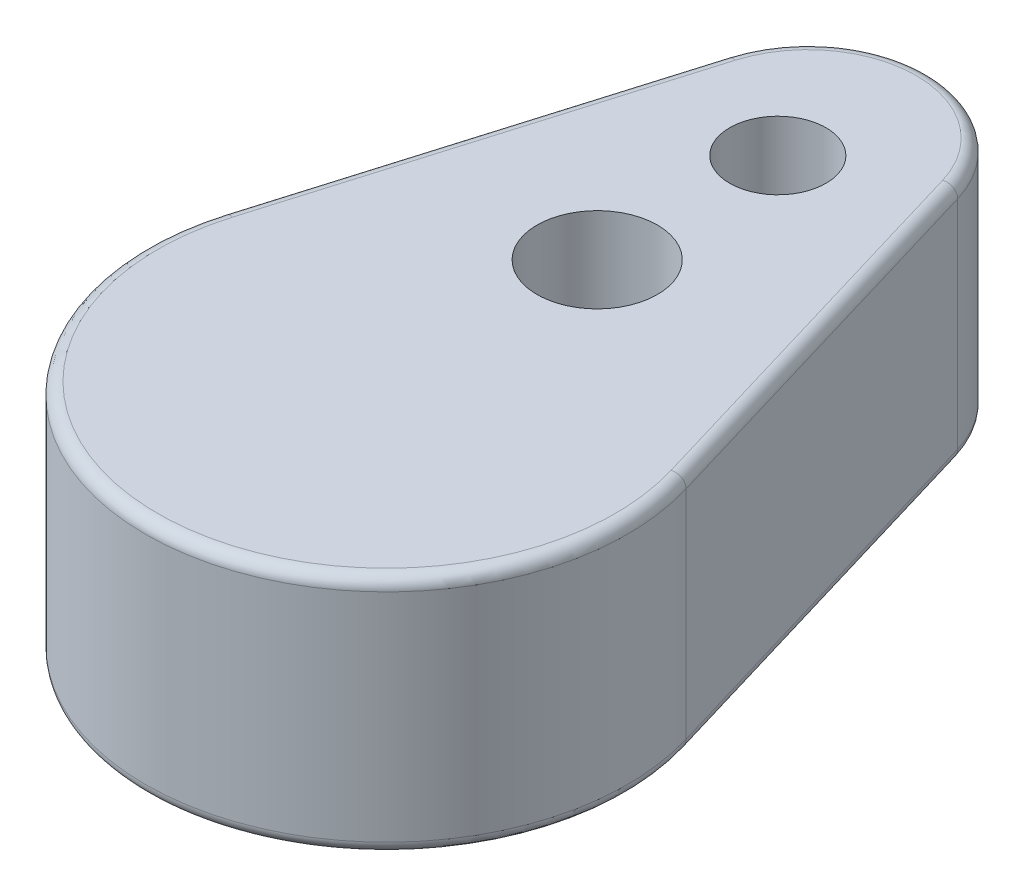
from build123d import *

# Parameters (mm, degrees)
BOSS_EXTRUDE1_DEPTH     = 20
FILLET1_R               = 1
SKETCH2_R               = 4
CUT_EXTRUDE1_DEPTH      = 15
SKETCH3_R               = 5
CUT_EXTRUDE2_DEPTH      = 15
CUT_EXTRUDE3_DEPTH      = 46.069390988
CUT_EXTRUDE3_DEPTH_BACK = 46.069390988
SKETCH4_R               = 4.1
SKETCH4_R_2             = 4


with BuildPart() as part:
    # Sketch1 → Boss-Extrude1 (new body)
    with BuildSketch(Plane(origin=(0, 0, 0), x_dir=(1, 0, 0), z_dir=(0, 1, 0))):
        with BuildLine():
            Line((-9.583148475, 20.357142857), (-19.16629695, -11.785714286))
            ThreePointArc((-19.16629695, -11.785714286), (0, -37.5), (19.16629695, -11.785714286))
            Line((19.16629695, -11.785714286), (9.583148475, 20.357142857))
            ThreePointArc((9.583148475, 20.357142857), (0, 27.5), (-9.583148475, 20.357142857))
        make_face()
    extrude(amount=BOSS_EXTRUDE1_DEPTH)

    # Fillet1
    fillet1_edges = [part.edges().sort_by_distance(p)[0] for p in [
        (0, 20, -27.5),
        (-14.374722712, 20, -4.285714286),
        (0, 20, 37.5),
        (-14.374722712, 0, -4.285714286),
        (0, 0, -27.5),
        (14.374722712, 0, -4.285714286),
        (0, 0, 37.5),
        (14.374722712, 20, -4.285714286),
    ]]
    fillet(fillet1_edges, radius=FILLET1_R)

    # Sketch2 → Cut-Extrude1 (cut)
    with BuildSketch(Plane(origin=(0, 0, 0), x_dir=(1, 0, 0), z_dir=(0, 1, 0))):
        with Locations(Location((0, 15, 0), (0, 0, 270))):
            Circle(SKETCH2_R)
    extrude(amount=CUT_EXTRUDE1_DEPTH, mode=Mode.SUBTRACT)

    # Sketch3 → Cut-Extrude2 (cut)
    with BuildSketch(Plane.XZ.offset(-20)):
        with Locations(Location((0, 0, 0), (0, 0, 270))):
            Circle(SKETCH3_R)
    extrude(amount=CUT_EXTRUDE2_DEPTH, mode=Mode.SUBTRACT)

    # Sketch4 → Cut-Extrude3 (cut, two sides: drawn at the far end of the back side and taken through both)
    with BuildSketch(Plane(origin=(0, 5, 0), x_dir=(-1, 0, 0), z_dir=(0, 1, 0)).offset(-CUT_EXTRUDE3_DEPTH_BACK)):
        with Locations(Location((0, 0, 0), (0, 0, 90))):
            Circle(SKETCH4_R)
        with Locations(Location((0, -15, 0), (0, 0, 90))):
            Circle(SKETCH4_R_2)
    extrude(amount=CUT_EXTRUDE3_DEPTH + CUT_EXTRUDE3_DEPTH_BACK, mode=Mode.SUBTRACT)


solid = part.part
